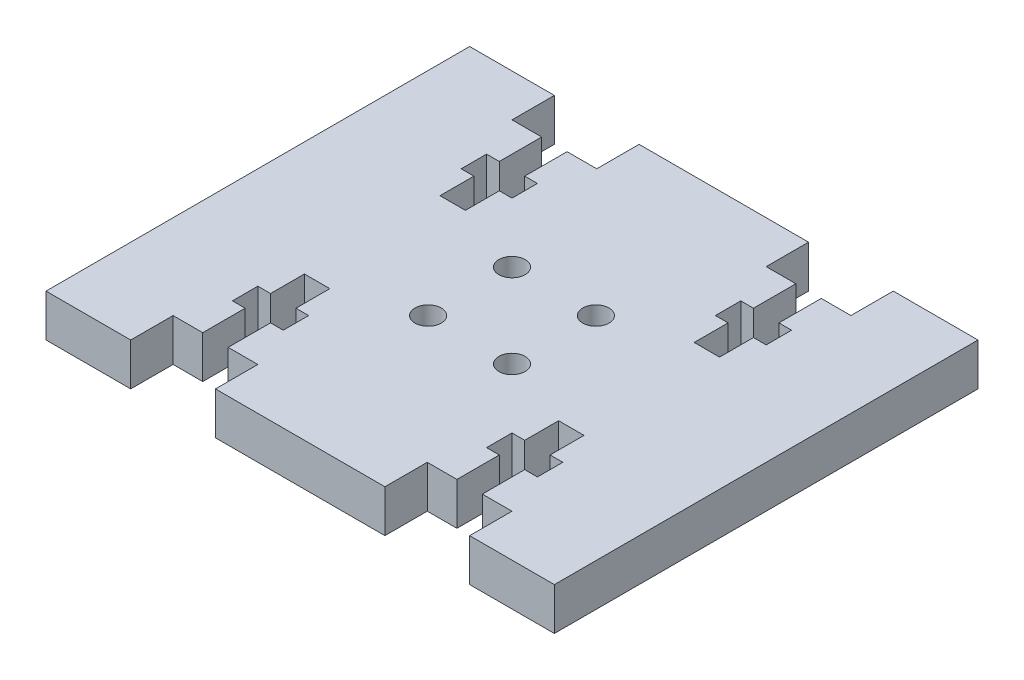
from build123d import *

# Parameters (mm, degrees)
SKETCH1_R           = 1.55
BOSS_EXTRUDE1_DEPTH = 5


with BuildPart() as part:
    # Sketch1 → Boss-Extrude1 (new body)
    with BuildSketch(Plane(origin=(0, 0, 0), x_dir=(1, 0, 0), z_dir=(0, 1, 0))):
        Polygon((-30, 25), (-30, -25), (-20, -25), (-20, -20), (-16.5, -20), (-16.5, -15), (-18, -15), (-18, -12), (-16.5, -12), (-16.5, -8), (-13.5, -8), (-13.5, -12), (-12, -12), (-12, -15), (-13.5, -15), (-13.5, -20), (-10, -20), (-10, -25), (10, -25), (10, -20), (13.5, -20), (13.5, -15), (12, -15), (12, -12), (13.5, -12), (13.5, -8), (16.5, -8), (16.5, -12), (18, -12), (18, -15), (16.5, -15), (16.5, -20), (20, -20), (20, -25), (30, -25), (30, 25), (20, 25), (20, 20), (16.5, 20), (16.5, 15), (18, 15), (18, 12), (16.5, 12), (16.5, 8), (13.5, 8), (13.5, 12), (12, 12), (12, 15), (13.5, 15), (13.5, 20), (10, 20), (10, 25), (-10, 25), (-10, 20), (-13.5, 20), (-13.5, 15), (-12, 15), (-12, 12), (-13.5, 12), (-13.5, 8), (-16.5, 8), (-16.5, 12), (-18, 12), (-18, 15), (-16.5, 15), (-16.5, 20), (-20, 20), (-20, 25), align=None)
        with Locations(Location((4.95, 4.95, 0), (0, 0, 270))):
            Circle(SKETCH1_R, mode=Mode.SUBTRACT)
        with Locations(Location((-4.95, -4.95, 0), (0, 0, 270))):
            Circle(SKETCH1_R, mode=Mode.SUBTRACT)
        with Locations(Location((4.95, -4.95, 0), (0, 0, 270))):
            Circle(SKETCH1_R, mode=Mode.SUBTRACT)
        with Locations(Location((-4.95, 4.95, 0), (0, 0, 270))):
            Circle(SKETCH1_R, mode=Mode.SUBTRACT)
    extrude(amount=BOSS_EXTRUDE1_DEPTH)


solid = part.part
